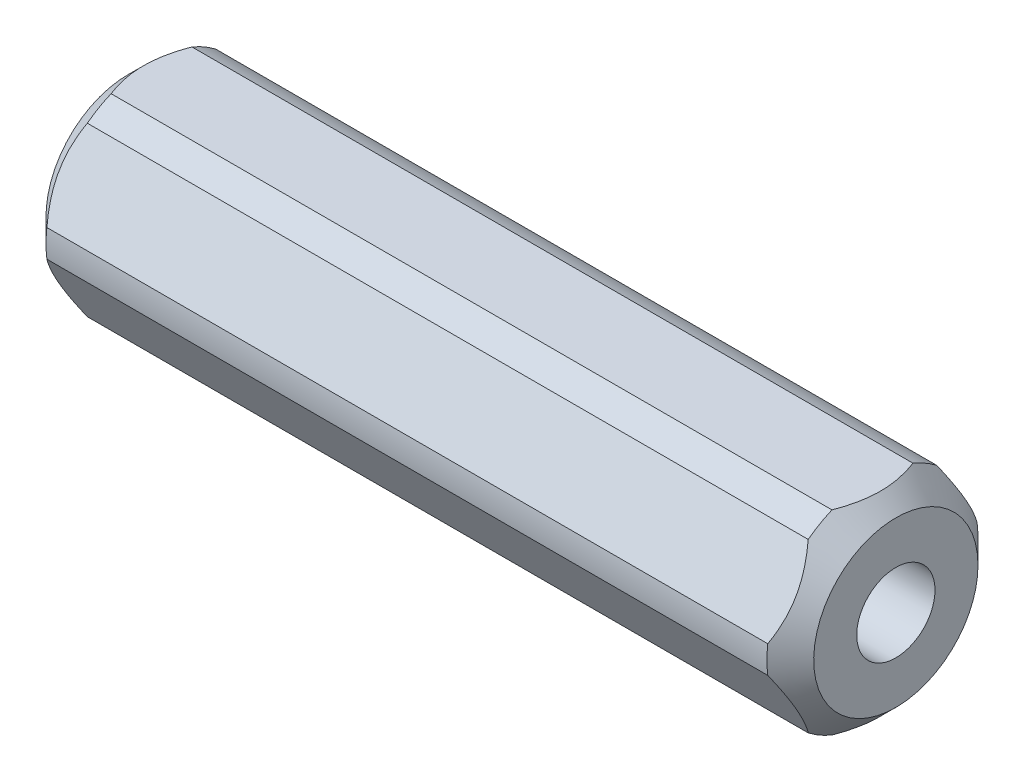
from build123d import *

# Parameters (mm, degrees)
EXTRUDE_476_DEPTH          = 25
CUT_EXTRUDE_647_DEPTH      = 27.815775829
CUT_EXTRUDE_647_DEPTH_BACK = 27.815775829
SKETCH_8_R                 = 8.875
SKETCH_8_R_2               = 6.875
CUT_EXTRUDE_851_DEPTH      = 27.694346312
CUT_EXTRUDE_851_DEPTH_BACK = 27.694346312
SKETCH_9_R                 = 2.55


with BuildPart() as part:
    # 草图1 → Extrude 476 (new, symmetric)
    with BuildSketch(Plane(origin=(0, 0, 0), x_dir=(0, 0, -1), z_dir=(1, 0, 0))):
        Polygon((7.332348419, 0), (3.666174209, 6.35), (-3.666174209, 6.35), (-7.332348419, 0), (-3.666174209, -6.35), (3.666174209, -6.35), align=None)
    extrude(amount=EXTRUDE_476_DEPTH, both=True)

    # 草图8 → Cut-Extrude 647 (cut, two sides: drawn at the far end of the back side and taken through both)
    with BuildSketch(Plane(origin=(0, 0, 0), x_dir=(0, 0, -1), z_dir=(1, 0, 0)).offset(-CUT_EXTRUDE_647_DEPTH_BACK)):
        Circle(SKETCH_8_R)
        Circle(SKETCH_8_R_2, mode=Mode.SUBTRACT)
    extrude(amount=CUT_EXTRUDE_647_DEPTH + CUT_EXTRUDE_647_DEPTH_BACK, mode=Mode.SUBTRACT)

    # 草图9 → Cut-Extrude 851 (cut, two sides: drawn at the far end of the back side and taken through both)
    with BuildSketch(Plane(origin=(0, 0, 0), x_dir=(0, 0, -1), z_dir=(1, 0, 0)).offset(-CUT_EXTRUDE_851_DEPTH_BACK)):
        Circle(SKETCH_9_R)
    extrude(amount=CUT_EXTRUDE_851_DEPTH + CUT_EXTRUDE_851_DEPTH_BACK, mode=Mode.SUBTRACT)

    # 草图10 → Cut-Revolve 1145 (revolve, cut)
    with BuildSketch(Plane.XY, mode=Mode.PRIVATE) as cut_revolve_1145_sk:
        Polygon((-26, 7.35), (-23, 7.35), (-26, 4.35), align=None)
        Polygon((23, 7.35), (26, 4.35), (26, 7.35), align=None)
    revolve(cut_revolve_1145_sk.sketch.rotate(Axis((25, 0, 0), (-1, 0, 0)), 157.463629785), axis=Axis((25, 0, 0), (-1, 0, 0)), mode=Mode.SUBTRACT)


solid = part.part
